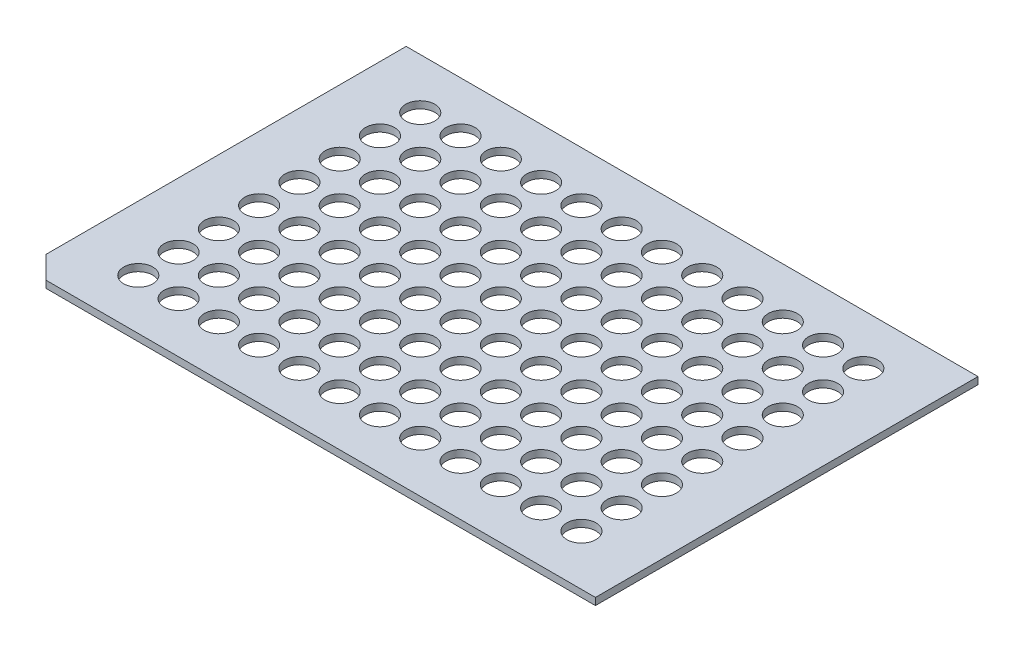
from build123d import *

# Parameters (mm, degrees)
SKETCH1_R           = 3.25
BOSS_EXTRUDE1_DEPTH = 1.5875


with BuildPart() as part:
    # Sketch1 → Boss-Extrude1 (new body)
    with BuildSketch(Plane(origin=(0, 0, 0), x_dir=(1, 0, 0), z_dir=(0, 1, 0))):
        Polygon((0, 5), (5, 0), (127.76, 0), (127.76, 85.48), (0, 85.48), align=None)
        with Locations(Location((14.38, 74.24, 0), (0, 0, 270))):
            Circle(SKETCH1_R, mode=Mode.SUBTRACT)
        with Locations(Location((23.38, 74.24, 0), (0, 0, 270))):
            Circle(SKETCH1_R, mode=Mode.SUBTRACT)
        with Locations(Location((32.38, 74.24, 0), (0, 0, 270))):
            Circle(SKETCH1_R, mode=Mode.SUBTRACT)
        with Locations(Location((41.38, 74.24, 0), (0, 0, 270))):
            Circle(SKETCH1_R, mode=Mode.SUBTRACT)
        with Locations(Location((50.38, 74.24, 0), (0, 0, 270))):
            Circle(SKETCH1_R, mode=Mode.SUBTRACT)
        with Locations(Location((59.38, 74.24, 0), (0, 0, 270))):
            Circle(SKETCH1_R, mode=Mode.SUBTRACT)
        with Locations(Location((68.38, 74.24, 0), (0, 0, 270))):
            Circle(SKETCH1_R, mode=Mode.SUBTRACT)
        with Locations(Location((77.38, 74.24, 0), (0, 0, 270))):
            Circle(SKETCH1_R, mode=Mode.SUBTRACT)
        with Locations(Location((86.38, 74.24, 0), (0, 0, 270))):
            Circle(SKETCH1_R, mode=Mode.SUBTRACT)
        with Locations(Location((95.38, 74.24, 0), (0, 0, 270))):
            Circle(SKETCH1_R, mode=Mode.SUBTRACT)
        with Locations(Location((104.38, 74.24, 0), (0, 0, 270))):
            Circle(SKETCH1_R, mode=Mode.SUBTRACT)
        with Locations(Location((113.38, 74.24, 0), (0, 0, 270))):
            Circle(SKETCH1_R, mode=Mode.SUBTRACT)
        with Locations(Location((23.38, 65.24, 0), (0, 0, 270))):
            Circle(SKETCH1_R, mode=Mode.SUBTRACT)
        with Locations(Location((32.38, 65.24, 0), (0, 0, 270))):
            Circle(SKETCH1_R, mode=Mode.SUBTRACT)
        with Locations(Location((41.38, 65.24, 0), (0, 0, 270))):
            Circle(SKETCH1_R, mode=Mode.SUBTRACT)
        with Locations(Location((50.38, 65.24, 0), (0, 0, 270))):
            Circle(SKETCH1_R, mode=Mode.SUBTRACT)
        with Locations(Location((59.38, 65.24, 0), (0, 0, 270))):
            Circle(SKETCH1_R, mode=Mode.SUBTRACT)
        with Locations(Location((68.38, 65.24, 0), (0, 0, 270))):
            Circle(SKETCH1_R, mode=Mode.SUBTRACT)
        with Locations(Location((77.38, 65.24, 0), (0, 0, 270))):
            Circle(SKETCH1_R, mode=Mode.SUBTRACT)
        with Locations(Location((86.38, 65.24, 0), (0, 0, 270))):
            Circle(SKETCH1_R, mode=Mode.SUBTRACT)
        with Locations(Location((95.38, 65.24, 0), (0, 0, 270))):
            Circle(SKETCH1_R, mode=Mode.SUBTRACT)
        with Locations(Location((104.38, 65.24, 0), (0, 0, 270))):
            Circle(SKETCH1_R, mode=Mode.SUBTRACT)
        with Locations(Location((113.38, 65.24, 0), (0, 0, 270))):
            Circle(SKETCH1_R, mode=Mode.SUBTRACT)
        with Locations(Location((23.38, 56.24, 0), (0, 0, 270))):
            Circle(SKETCH1_R, mode=Mode.SUBTRACT)
        with Locations(Location((32.38, 56.24, 0), (0, 0, 270))):
            Circle(SKETCH1_R, mode=Mode.SUBTRACT)
        with Locations(Location((41.38, 56.24, 0), (0, 0, 270))):
            Circle(SKETCH1_R, mode=Mode.SUBTRACT)
        with Locations(Location((50.38, 56.24, 0), (0, 0, 270))):
            Circle(SKETCH1_R, mode=Mode.SUBTRACT)
        with Locations(Location((59.38, 56.24, 0), (0, 0, 270))):
            Circle(SKETCH1_R, mode=Mode.SUBTRACT)
        with Locations(Location((68.38, 56.24, 0), (0, 0, 270))):
            Circle(SKETCH1_R, mode=Mode.SUBTRACT)
        with Locations(Location((77.38, 56.24, 0), (0, 0, 270))):
            Circle(SKETCH1_R, mode=Mode.SUBTRACT)
        with Locations(Location((86.38, 56.24, 0), (0, 0, 270))):
            Circle(SKETCH1_R, mode=Mode.SUBTRACT)
        with Locations(Location((95.38, 56.24, 0), (0, 0, 270))):
            Circle(SKETCH1_R, mode=Mode.SUBTRACT)
        with Locations(Location((104.38, 56.24, 0), (0, 0, 270))):
            Circle(SKETCH1_R, mode=Mode.SUBTRACT)
        with Locations(Location((113.38, 56.24, 0), (0, 0, 270))):
            Circle(SKETCH1_R, mode=Mode.SUBTRACT)
        with Locations(Location((23.38, 47.24, 0), (0, 0, 270))):
            Circle(SKETCH1_R, mode=Mode.SUBTRACT)
        with Locations(Location((32.38, 47.24, 0), (0, 0, 270))):
            Circle(SKETCH1_R, mode=Mode.SUBTRACT)
        with Locations(Location((41.38, 47.24, 0), (0, 0, 270))):
            Circle(SKETCH1_R, mode=Mode.SUBTRACT)
        with Locations(Location((50.38, 47.24, 0), (0, 0, 270))):
            Circle(SKETCH1_R, mode=Mode.SUBTRACT)
        with Locations(Location((59.38, 47.24, 0), (0, 0, 270))):
            Circle(SKETCH1_R, mode=Mode.SUBTRACT)
        with Locations(Location((68.38, 47.24, 0), (0, 0, 270))):
            Circle(SKETCH1_R, mode=Mode.SUBTRACT)
        with Locations(Location((77.38, 47.24, 0), (0, 0, 270))):
            Circle(SKETCH1_R, mode=Mode.SUBTRACT)
        with Locations(Location((86.38, 47.24, 0), (0, 0, 270))):
            Circle(SKETCH1_R, mode=Mode.SUBTRACT)
        with Locations(Location((95.38, 47.24, 0), (0, 0, 270))):
            Circle(SKETCH1_R, mode=Mode.SUBTRACT)
        with Locations(Location((104.38, 47.24, 0), (0, 0, 270))):
            Circle(SKETCH1_R, mode=Mode.SUBTRACT)
        with Locations(Location((113.38, 47.24, 0), (0, 0, 270))):
            Circle(SKETCH1_R, mode=Mode.SUBTRACT)
        with Locations(Location((23.38, 38.24, 0), (0, 0, 270))):
            Circle(SKETCH1_R, mode=Mode.SUBTRACT)
        with Locations(Location((32.38, 38.24, 0), (0, 0, 270))):
            Circle(SKETCH1_R, mode=Mode.SUBTRACT)
        with Locations(Location((41.38, 38.24, 0), (0, 0, 270))):
            Circle(SKETCH1_R, mode=Mode.SUBTRACT)
        with Locations(Location((50.38, 38.24, 0), (0, 0, 270))):
            Circle(SKETCH1_R, mode=Mode.SUBTRACT)
        with Locations(Location((59.38, 38.24, 0), (0, 0, 270))):
            Circle(SKETCH1_R, mode=Mode.SUBTRACT)
        with Locations(Location((68.38, 38.24, 0), (0, 0, 270))):
            Circle(SKETCH1_R, mode=Mode.SUBTRACT)
        with Locations(Location((77.38, 38.24, 0), (0, 0, 270))):
            Circle(SKETCH1_R, mode=Mode.SUBTRACT)
        with Locations(Location((86.38, 38.24, 0), (0, 0, 270))):
            Circle(SKETCH1_R, mode=Mode.SUBTRACT)
        with Locations(Location((95.38, 38.24, 0), (0, 0, 270))):
            Circle(SKETCH1_R, mode=Mode.SUBTRACT)
        with Locations(Location((104.38, 38.24, 0), (0, 0, 270))):
            Circle(SKETCH1_R, mode=Mode.SUBTRACT)
        with Locations(Location((113.38, 38.24, 0), (0, 0, 270))):
            Circle(SKETCH1_R, mode=Mode.SUBTRACT)
        with Locations(Location((23.38, 29.24, 0), (0, 0, 270))):
            Circle(SKETCH1_R, mode=Mode.SUBTRACT)
        with Locations(Location((32.38, 29.24, 0), (0, 0, 270))):
            Circle(SKETCH1_R, mode=Mode.SUBTRACT)
        with Locations(Location((41.38, 29.24, 0), (0, 0, 270))):
            Circle(SKETCH1_R, mode=Mode.SUBTRACT)
        with Locations(Location((50.38, 29.24, 0), (0, 0, 270))):
            Circle(SKETCH1_R, mode=Mode.SUBTRACT)
        with Locations(Location((59.38, 29.24, 0), (0, 0, 270))):
            Circle(SKETCH1_R, mode=Mode.SUBTRACT)
        with Locations(Location((68.38, 29.24, 0), (0, 0, 270))):
            Circle(SKETCH1_R, mode=Mode.SUBTRACT)
        with Locations(Location((77.38, 29.24, 0), (0, 0, 270))):
            Circle(SKETCH1_R, mode=Mode.SUBTRACT)
        with Locations(Location((86.38, 29.24, 0), (0, 0, 270))):
            Circle(SKETCH1_R, mode=Mode.SUBTRACT)
        with Locations(Location((95.38, 29.24, 0), (0, 0, 270))):
            Circle(SKETCH1_R, mode=Mode.SUBTRACT)
        with Locations(Location((104.38, 29.24, 0), (0, 0, 270))):
            Circle(SKETCH1_R, mode=Mode.SUBTRACT)
        with Locations(Location((113.38, 29.24, 0), (0, 0, 270))):
            Circle(SKETCH1_R, mode=Mode.SUBTRACT)
        with Locations(Location((23.38, 20.24, 0), (0, 0, 270))):
            Circle(SKETCH1_R, mode=Mode.SUBTRACT)
        with Locations(Location((32.38, 20.24, 0), (0, 0, 270))):
            Circle(SKETCH1_R, mode=Mode.SUBTRACT)
        with Locations(Location((41.38, 20.24, 0), (0, 0, 270))):
            Circle(SKETCH1_R, mode=Mode.SUBTRACT)
        with Locations(Location((50.38, 20.24, 0), (0, 0, 270))):
            Circle(SKETCH1_R, mode=Mode.SUBTRACT)
        with Locations(Location((59.38, 20.24, 0), (0, 0, 270))):
            Circle(SKETCH1_R, mode=Mode.SUBTRACT)
        with Locations(Location((68.38, 20.24, 0), (0, 0, 270))):
            Circle(SKETCH1_R, mode=Mode.SUBTRACT)
        with Locations(Location((77.38, 20.24, 0), (0, 0, 270))):
            Circle(SKETCH1_R, mode=Mode.SUBTRACT)
        with Locations(Location((86.38, 20.24, 0), (0, 0, 270))):
            Circle(SKETCH1_R, mode=Mode.SUBTRACT)
        with Locations(Location((95.38, 20.24, 0), (0, 0, 270))):
            Circle(SKETCH1_R, mode=Mode.SUBTRACT)
        with Locations(Location((104.38, 20.24, 0), (0, 0, 270))):
            Circle(SKETCH1_R, mode=Mode.SUBTRACT)
        with Locations(Location((113.38, 20.24, 0), (0, 0, 270))):
            Circle(SKETCH1_R, mode=Mode.SUBTRACT)
        with Locations(Location((23.38, 11.24, 0), (0, 0, 270))):
            Circle(SKETCH1_R, mode=Mode.SUBTRACT)
        with Locations(Location((32.38, 11.24, 0), (0, 0, 270))):
            Circle(SKETCH1_R, mode=Mode.SUBTRACT)
        with Locations(Location((41.38, 11.24, 0), (0, 0, 270))):
            Circle(SKETCH1_R, mode=Mode.SUBTRACT)
        with Locations(Location((50.38, 11.24, 0), (0, 0, 270))):
            Circle(SKETCH1_R, mode=Mode.SUBTRACT)
        with Locations(Location((59.38, 11.24, 0), (0, 0, 270))):
            Circle(SKETCH1_R, mode=Mode.SUBTRACT)
        with Locations(Location((68.38, 11.24, 0), (0, 0, 270))):
            Circle(SKETCH1_R, mode=Mode.SUBTRACT)
        with Locations(Location((77.38, 11.24, 0), (0, 0, 270))):
            Circle(SKETCH1_R, mode=Mode.SUBTRACT)
        with Locations(Location((86.38, 11.24, 0), (0, 0, 270))):
            Circle(SKETCH1_R, mode=Mode.SUBTRACT)
        with Locations(Location((95.38, 11.24, 0), (0, 0, 270))):
            Circle(SKETCH1_R, mode=Mode.SUBTRACT)
        with Locations(Location((104.38, 11.24, 0), (0, 0, 270))):
            Circle(SKETCH1_R, mode=Mode.SUBTRACT)
        with Locations(Location((113.38, 11.24, 0), (0, 0, 270))):
            Circle(SKETCH1_R, mode=Mode.SUBTRACT)
        with Locations(Location((14.38, 65.24, 0), (0, 0, 270))):
            Circle(SKETCH1_R, mode=Mode.SUBTRACT)
        with Locations(Location((14.38, 56.24, 0), (0, 0, 270))):
            Circle(SKETCH1_R, mode=Mode.SUBTRACT)
        with Locations(Location((14.38, 47.24, 0), (0, 0, 270))):
            Circle(SKETCH1_R, mode=Mode.SUBTRACT)
        with Locations(Location((14.38, 38.24, 0), (0, 0, 270))):
            Circle(SKETCH1_R, mode=Mode.SUBTRACT)
        with Locations(Location((14.38, 29.24, 0), (0, 0, 270))):
            Circle(SKETCH1_R, mode=Mode.SUBTRACT)
        with Locations(Location((14.38, 20.24, 0), (0, 0, 270))):
            Circle(SKETCH1_R, mode=Mode.SUBTRACT)
        with Locations(Location((14.38, 11.24, 0), (0, 0, 270))):
            Circle(SKETCH1_R, mode=Mode.SUBTRACT)
    extrude(amount=BOSS_EXTRUDE1_DEPTH)


solid = part.part
